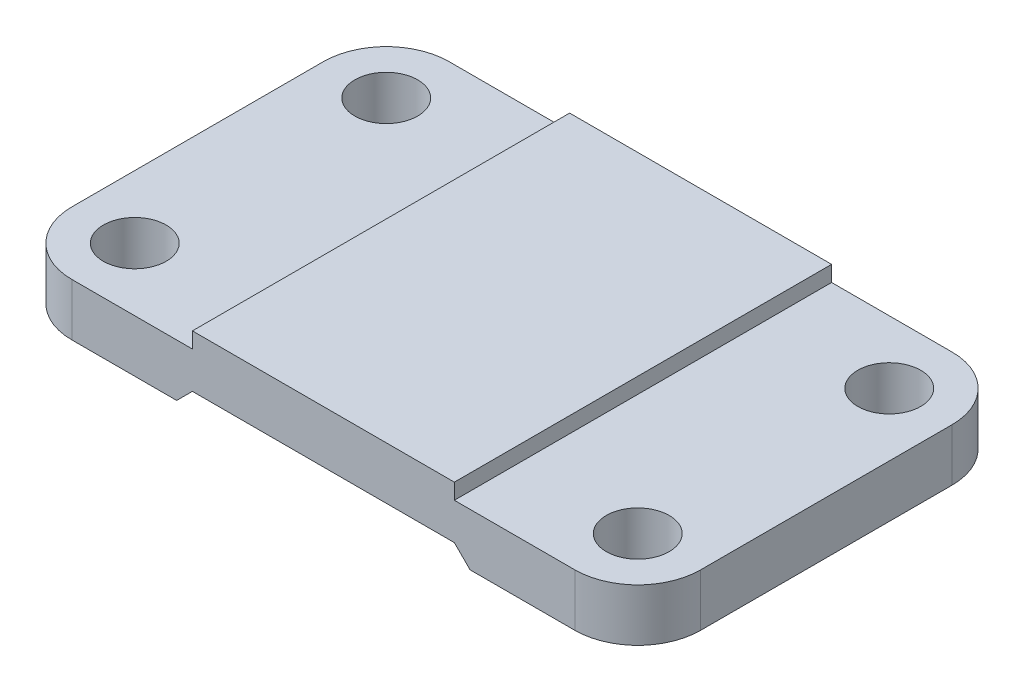
from build123d import *

# Parameters (mm, degrees)
SKETCH3_R           = 6
BOSS_EXTRUDE1_DEPTH = 10
SKETCH4_W           = 50
SKETCH4_H           = 72
BOSS_EXTRUDE2_DEPTH = 3
CUT_EXTRUDE1_DEPTH  = 95.620293806


with BuildPart() as part:
    # Sketch3 → Boss-Extrude1 (new body)
    with BuildSketch(Plane(origin=(0, 0, 0), x_dir=(1, 0, 0), z_dir=(0, 1, 0))):
        with BuildLine():
            Line((48, -36), (-48, -36))
            ThreePointArc((-48, -36), (-56.485281374, -32.485281374), (-60, -24))
            Line((-60, -24), (-60, 24))
            ThreePointArc((-60, 24), (-56.485281374, 32.485281374), (-48, 36))
            Line((-48, 36), (48, 36))
            ThreePointArc((48, 36), (56.485281374, 32.485281374), (60, 24))
            Line((60, 24), (60, -24))
            ThreePointArc((60, -24), (56.485281374, -32.485281374), (48, -36))
        make_face()
        with Locations(Location((-48, 24, 0), (0, 0, 270))):
            Circle(SKETCH3_R, mode=Mode.SUBTRACT)
        with Locations(Location((-48, -24, 0), (0, 0, 270))):
            Circle(SKETCH3_R, mode=Mode.SUBTRACT)
        with Locations(Location((48, -24, 0), (0, 0, 270))):
            Circle(SKETCH3_R, mode=Mode.SUBTRACT)
        with Locations(Location((48, 24, 0), (0, 0, 270))):
            Circle(SKETCH3_R, mode=Mode.SUBTRACT)
    extrude(amount=BOSS_EXTRUDE1_DEPTH)

    # Sketch4 → Boss-Extrude2 (add)
    with BuildSketch(Plane(origin=(0, 10, 0), x_dir=(1, 0, 0), z_dir=(0, 1, 0))):
        Rectangle(SKETCH4_W, SKETCH4_H)
    extrude(amount=BOSS_EXTRUDE2_DEPTH)

    # Sketch5 → Cut-Extrude1 (cut, through all)
    with BuildSketch(Plane.XY.offset(36)):
        Polygon((0, 0), (28, 0), (25, 3), (-25, 3), (-28, 0), align=None)
    extrude(amount=-CUT_EXTRUDE1_DEPTH, mode=Mode.SUBTRACT)


solid = part.part
